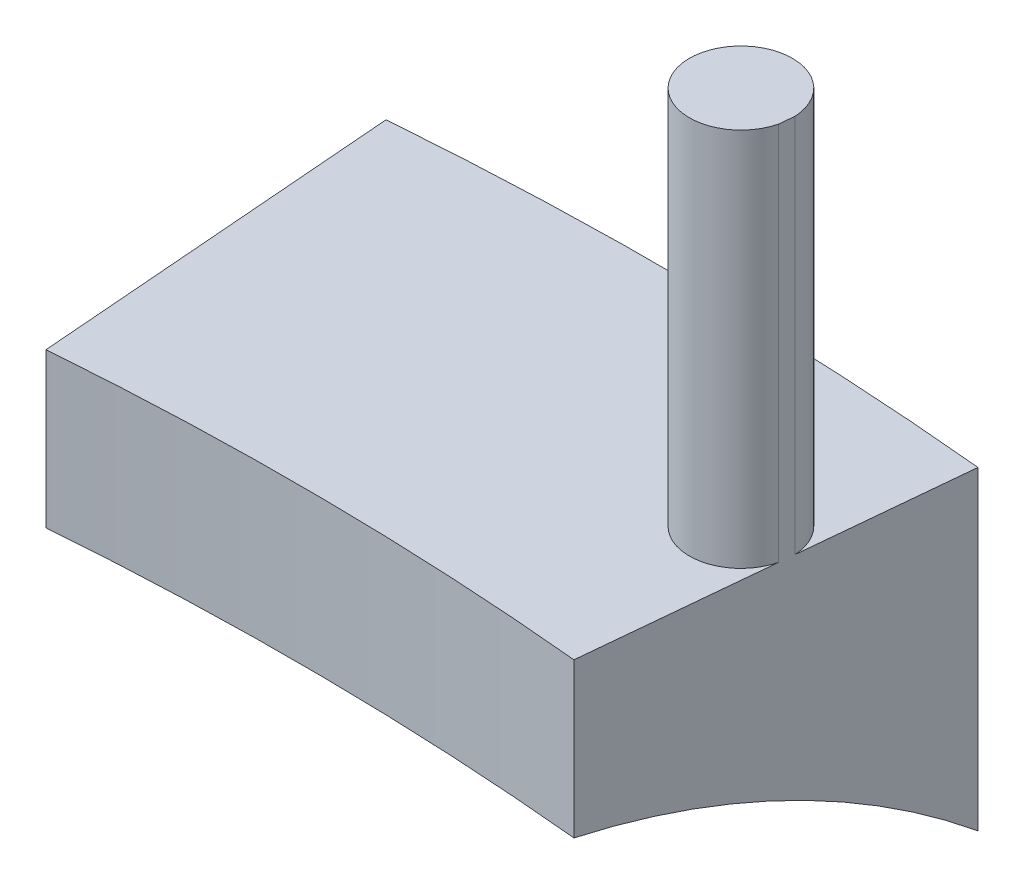
from build123d import *

# Parameters (mm, degrees)
SKETCH1_R           = 140.97
SKETCH1_R_2         = 125.73
BOSS_EXTRUDE1_DEPTH = 12.954
CUT_EXTRUDE1_START  = -12.954
CUT_EXTRUDE1_DEPTH  = 12.954
SKETCH5_R           = 2.1209
BOSS_EXTRUDE2_DEPTH = 28.575
SKETCH6_W           = 35.941656598
SKETCH6_H           = 50
CUT_EXTRUDE2_DEPTH  = 25.4


with BuildPart() as part:
    # Sketch1 → Boss-Extrude1 (new body)
    with BuildSketch(Plane(origin=(0, 0, 0), x_dir=(1, 0, 0), z_dir=(0, 1, 0))):
        with Locations(Location((0, 0, 0), (0, 0, 270))):
            Circle(SKETCH1_R)
        with Locations(Location((0, 0, 0), (0, 0, 270))):
            Circle(SKETCH1_R_2, mode=Mode.SUBTRACT)
    extrude(amount=BOSS_EXTRUDE1_DEPTH)

    # Sketch3 → Cut-Extrude1 (cut)
    with BuildSketch(Plane(origin=(0, 12.954, 0), x_dir=(1, 0, 0), z_dir=(0, 1, 0)).offset(CUT_EXTRUDE1_START)):
        with BuildLine():
            Line((13.491584054, 140.322906397), (12.033034426, 125.152862462))
            ThreePointArc((12.033034426, 125.152862462), (93.061663209, 84.54324184), (125.73, 0))
            ThreePointArc((125.73, 0), (-85.339106447, -92.332387659), (-9.882340901, 125.341023764))
            Line((-9.882340901, 125.341023764), (-11.080200404, 140.53387513))
            ThreePointArc((-11.080200404, 140.53387513), (-95.683240562, -103.524192223), (140.97, 0))
            ThreePointArc((140.97, 0), (104.34186481, 94.790907517), (13.491584054, 140.322906397))
        make_face()
    extrude(amount=CUT_EXTRUDE1_DEPTH, mode=Mode.SUBTRACT)

    # Sketch5 → Boss-Extrude2 (add)
    with BuildSketch(Plane(origin=(0, 0, 0), x_dir=(1, 0, 0), z_dir=(0, 1, 0))):
        with Locations(Location((10.71230924, 133.345085246, 0), (0, 0, 2.80489485))):
            Circle(SKETCH5_R)
    extrude(amount=BOSS_EXTRUDE2_DEPTH)

    # Sketch2 → Cut-Revolve1 (revolve, cut)
    with BuildSketch(Plane.XY):
        with BuildLine():
            Line((-125.73, 6.604), (-125.73, 0))
            Line((-125.73, 0), (-140.97, 0))
            ThreePointArc((-140.97, 0), (-133.78949329, 4.316215284), (-125.73, 6.604))
        make_face()
    revolve(axis=Axis((0, 0, 0), (0, 1, 0)), mode=Mode.SUBTRACT)

    # Sketch6 → Cut-Extrude2 (cut)
    with BuildSketch(Plane(origin=(0, 0, 0), x_dir=(0.09570535612916914, 0, -0.9954097070092239), z_dir=(0.995409707009224, 0, 0.09570535612916914))):
        with Locations((132.91957607, 23.563430101)):
            Rectangle(SKETCH6_W, SKETCH6_H)
    extrude(amount=CUT_EXTRUDE2_DEPTH, mode=Mode.SUBTRACT)


solid = part.part
